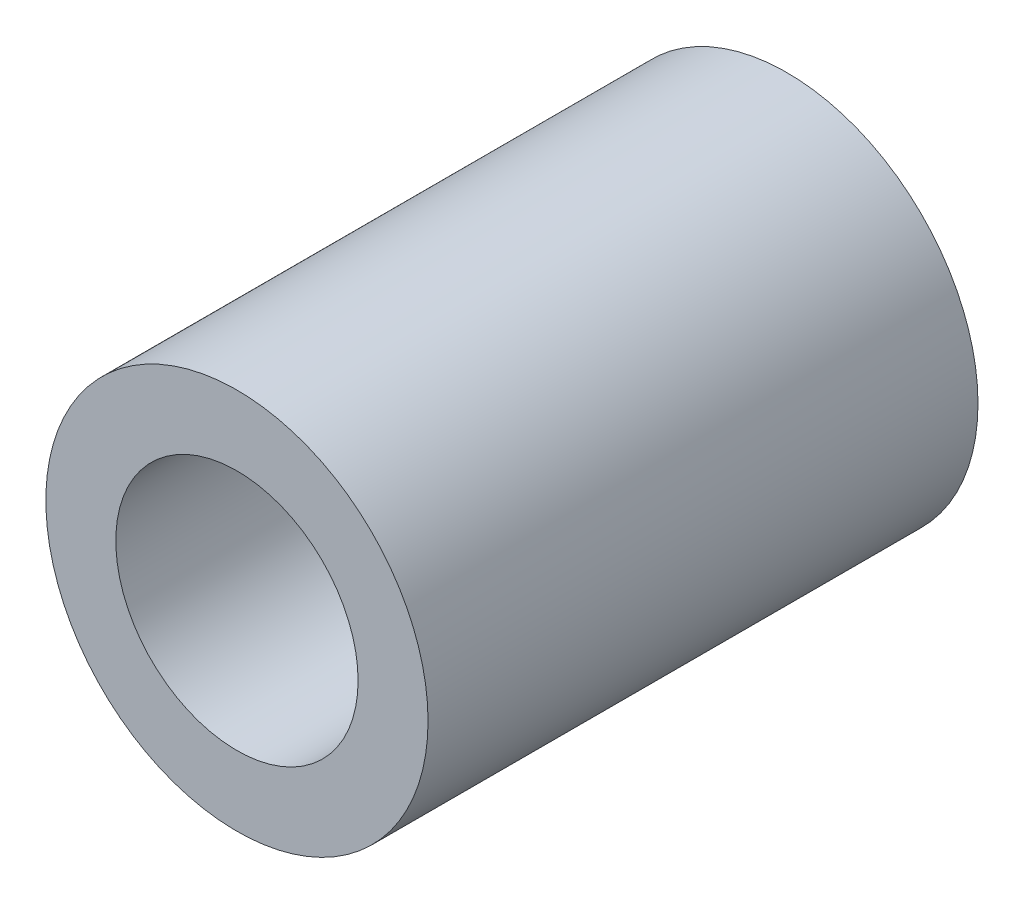
from build123d import *

# Parameters (mm, degrees)
EXTRUDE_1_DEPTH      = 3.9
EXTRUDE_1_DEPTH_BACK = 7.5
SKETCH_1_R           = 3.961318837
SKETCH_1_R_2         = 2.511318837


with BuildPart() as part:
    # 草图1 → 拉伸-薄壁1 (new, two sides: drawn at the far end of the back side and taken through both)
    with BuildSketch(Plane.XY.offset(-EXTRUDE_1_DEPTH_BACK)):
        Circle(SKETCH_1_R)
        Circle(SKETCH_1_R_2, mode=Mode.SUBTRACT)
    extrude(amount=EXTRUDE_1_DEPTH + EXTRUDE_1_DEPTH_BACK)


solid = part.part
